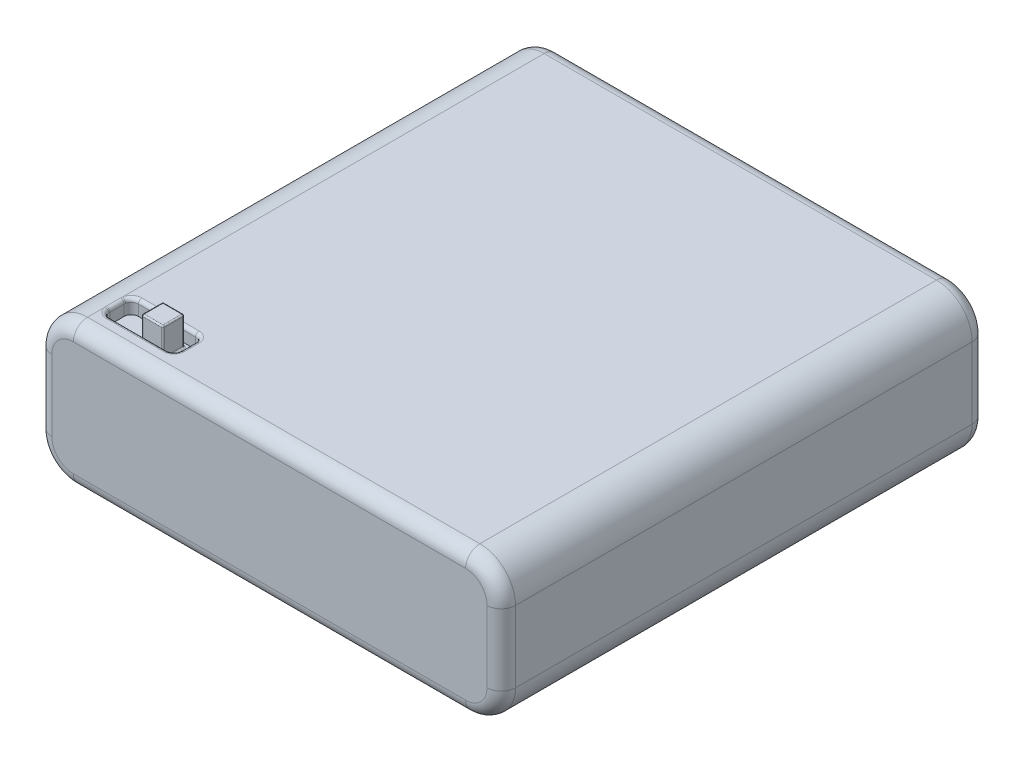
from build123d import *

# Parameters (mm, degrees)
SKETCH1_W           = 65
SKETCH1_H           = 68
BOSS_EXTRUDE1_DEPTH = 20
FILLET1_R           = 5
FILLET2_R           = 2
CUT_EXTRUDE1_DEPTH  = 2
FILLET3_R           = 0.5
SKETCH3_W           = 3
SKETCH3_H           = 3
BOSS_EXTRUDE2_DEPTH = 4
FILLET4_R           = 0.2


with BuildPart() as part:
    # Sketch1 → Boss-Extrude1 (new body)
    with BuildSketch(Plane(origin=(0, 0, 0), x_dir=(1, 0, 0), z_dir=(0, 1, 0))):
        Rectangle(SKETCH1_W, SKETCH1_H)
    extrude(amount=BOSS_EXTRUDE1_DEPTH)

    # Fillet1
    fillet1_edges = [part.edges().sort_by_distance(p)[0] for p in [
        (-32.5, 20, 0),
        (32.5, 20, 0),
        (-32.5, 0, 0),
        (32.5, 0, 0),
    ]]
    fillet(fillet1_edges, radius=FILLET1_R)

    # Fillet2
    fillet2_edges = [part.edges().sort_by_distance(p)[0] for p in [
        (-32.5, 10, 34),
        (-32.5, 10, -34),
        (0, 0, 34),
        (32.5, 10, 34),
        (0, 20, 34),
        (31.035533906, 18.535533906, 34),
        (31.035533906, 1.464466094, 34),
        (-31.035533906, 18.535533906, 34),
        (-31.035533906, 1.464466094, 34),
        (0, 0, -34),
        (0, 20, -34),
        (32.5, 10, -34),
        (31.035533906, 18.535533906, -34),
        (31.035533906, 1.464466094, -34),
        (-31.035533906, 18.535533906, -34),
        (-31.035533906, 1.464466094, -34),
    ]]
    fillet(fillet2_edges, radius=FILLET2_R)

    # Sketch2 → Cut-Extrude1 (cut)
    with BuildSketch(Plane(origin=(0, 20, 0), x_dir=(1, 0, 0), z_dir=(0, 1, 0))):
        with BuildLine():
            Line((-26.022422588, -26.349516296), (-18.022422588, -26.349516296))
            ThreePointArc((-18.022422588, -26.349516296), (-17.315315807, -26.642409515), (-17.022422588, -27.349516296))
            Line((-17.022422588, -27.349516296), (-17.022422588, -29.349516296))
            ThreePointArc((-17.022422588, -29.349516296), (-17.315315807, -30.056623077), (-18.022422588, -30.349516296))
            Line((-18.022422588, -30.349516296), (-26.022422588, -30.349516296))
            ThreePointArc((-26.022422588, -30.349516296), (-26.729529369, -30.056623077), (-27.022422588, -29.349516296))
            Line((-27.022422588, -29.349516296), (-27.022422588, -27.349516296))
            ThreePointArc((-27.022422588, -27.349516296), (-26.729529369, -26.642409515), (-26.022422588, -26.349516296))
        make_face()
    extrude(amount=-CUT_EXTRUDE1_DEPTH, mode=Mode.SUBTRACT)

    # Fillet3
    fillet3_edges = [part.edges().sort_by_distance(p)[0] for p in [
        (-26.729529369, 20, 26.642409515),
        (-27.022422588, 20, 28.349516296),
        (-26.729529369, 20, 30.056623077),
        (-22.022422588, 20, 30.349516296),
        (-17.315315807, 20, 30.056623077),
        (-17.022422588, 20, 28.349516296),
        (-17.315315807, 20, 26.642409515),
        (-22.022422588, 20, 26.349516296),
    ]]
    fillet(fillet3_edges, radius=FILLET3_R)

    # Sketch3 → Boss-Extrude2 (add)
    with BuildSketch(Plane(origin=(0, 18, 0), x_dir=(1, 0, 0), z_dir=(0, 1, 0))):
        with Locations((-20.584643458, -28.349516296)):
            Rectangle(SKETCH3_W, SKETCH3_H)
    extrude(amount=BOSS_EXTRUDE2_DEPTH)

    # Fillet4
    fillet4_edges = [part.edges().sort_by_distance(p)[0] for p in [
        (-19.084643458, 18, 28.349516296),
        (-19.084643458, 20, 29.849516296),
        (-20.584643458, 18, 26.849516296),
        (-19.084643458, 20, 26.849516296),
        (-22.084643458, 18, 28.349516296),
        (-22.084643458, 20, 26.849516296),
        (-20.584643458, 18, 29.849516296),
        (-22.084643458, 20, 29.849516296),
        (-19.084643458, 22, 28.349516296),
        (-20.584643458, 22, 26.849516296),
        (-22.084643458, 22, 28.349516296),
        (-20.584643458, 22, 29.849516296),
    ]]
    fillet(fillet4_edges, radius=FILLET4_R)


solid = part.part
